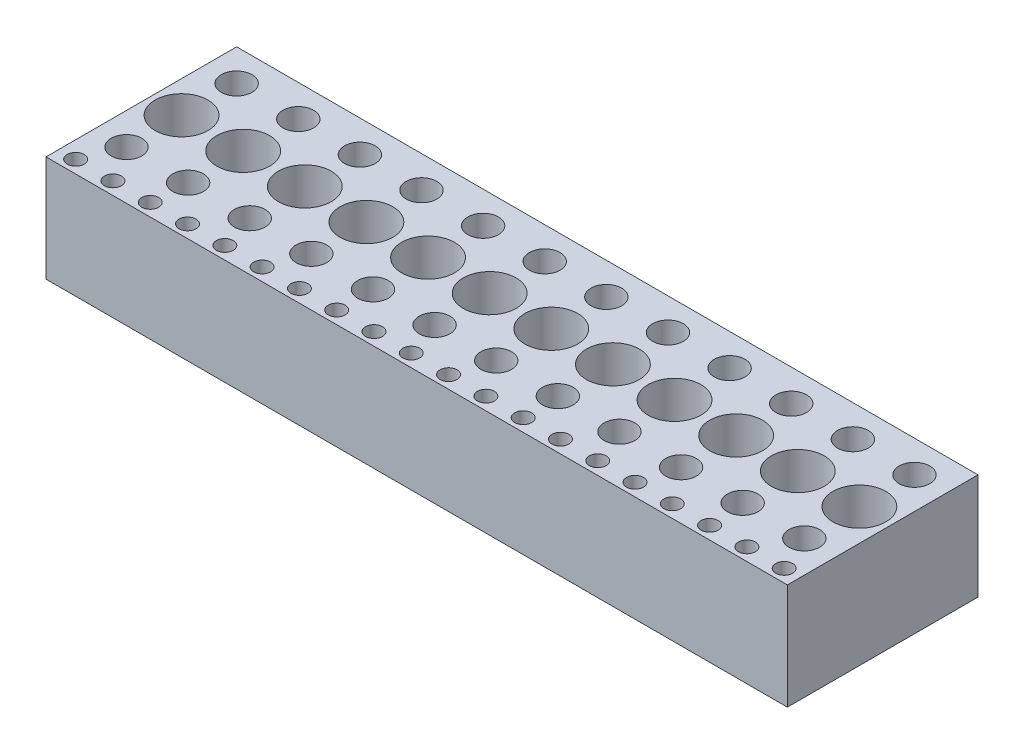
from build123d import *

# Parameters (mm, degrees)
SKETCH_1_W          = 35
SKETCH_1_H          = 9
EXTRUDE_1_DEPTH     = 5
SKETCH_2_R          = 0.725
SKETCH_2_R_2        = 1.25
SKETCH_2_R_3        = 0.4
CUT_EXTRUDE_1_DEPTH = 19.748333259


with BuildPart() as part:
    # 草图1 → 凸台-拉伸1 (new body)
    with BuildSketch(Plane(origin=(0, 0, 0), x_dir=(1, 0, 0), z_dir=(0, 1, 0))):
        Rectangle(SKETCH_1_W, SKETCH_1_H)
    extrude(amount=EXTRUDE_1_DEPTH)

    # 草图2 → 切除-拉伸1 (cut, through all)
    with BuildSketch(Plane(origin=(0, 5, 0), x_dir=(1, 0, 0), z_dir=(0, 1, 0))):
        with Locations(Location((-16, 3, 0), (0, 0, 270))):
            Circle(SKETCH_2_R)
        with Locations(Location((-13.090909091, 3, 0), (0, 0, 270))):
            Circle(SKETCH_2_R)
        with Locations(Location((-10.181818182, 3, 0), (0, 0, 270))):
            Circle(SKETCH_2_R)
        with Locations(Location((-7.272727273, 3, 0), (0, 0, 270))):
            Circle(SKETCH_2_R)
        with Locations(Location((-4.363636364, 3, 0), (0, 0, 270))):
            Circle(SKETCH_2_R)
        with Locations(Location((-1.454545455, 3, 0), (0, 0, 270))):
            Circle(SKETCH_2_R)
        with Locations(Location((1.454545455, 3, 0), (0, 0, 270))):
            Circle(SKETCH_2_R)
        with Locations(Location((4.363636364, 3, 0), (0, 0, 270))):
            Circle(SKETCH_2_R)
        with Locations(Location((7.272727273, 3, 0), (0, 0, 270))):
            Circle(SKETCH_2_R)
        with Locations(Location((10.181818182, 3, 0), (0, 0, 270))):
            Circle(SKETCH_2_R)
        with Locations(Location((13.090909091, 3, 0), (0, 0, 270))):
            Circle(SKETCH_2_R)
        with Locations(Location((16, 3, 0), (0, 0, 270))):
            Circle(SKETCH_2_R)
        with Locations(Location((-16, 0.4, 0), (0, 0, 270))):
            Circle(SKETCH_2_R_2)
        with Locations(Location((-13.090909091, 0.4, 0), (0, 0, 270))):
            Circle(SKETCH_2_R_2)
        with Locations(Location((-10.181818182, 0.4, 0), (0, 0, 270))):
            Circle(SKETCH_2_R_2)
        with Locations(Location((-7.272727273, 0.4, 0), (0, 0, 270))):
            Circle(SKETCH_2_R_2)
        with Locations(Location((-4.363636364, 0.4, 0), (0, 0, 270))):
            Circle(SKETCH_2_R_2)
        with Locations(Location((-1.454545455, 0.4, 0), (0, 0, 270))):
            Circle(SKETCH_2_R_2)
        with Locations(Location((1.454545455, 0.4, 0), (0, 0, 270))):
            Circle(SKETCH_2_R_2)
        with Locations(Location((4.363636364, 0.4, 0), (0, 0, 270))):
            Circle(SKETCH_2_R_2)
        with Locations(Location((7.272727273, 0.4, 0), (0, 0, 270))):
            Circle(SKETCH_2_R_2)
        with Locations(Location((10.181818182, 0.4, 0), (0, 0, 270))):
            Circle(SKETCH_2_R_2)
        with Locations(Location((13.090909091, 0.4, 0), (0, 0, 270))):
            Circle(SKETCH_2_R_2)
        with Locations(Location((16, 0.4, 0), (0, 0, 270))):
            Circle(SKETCH_2_R_2)
        with Locations(Location((-16, -2.2, 0), (0, 0, 270))):
            Circle(SKETCH_2_R)
        with Locations(Location((-13.090909091, -2.2, 0), (0, 0, 270))):
            Circle(SKETCH_2_R)
        with Locations(Location((-10.181818182, -2.2, 0), (0, 0, 270))):
            Circle(SKETCH_2_R)
        with Locations(Location((-7.272727273, -2.2, 0), (0, 0, 270))):
            Circle(SKETCH_2_R)
        with Locations(Location((-4.363636364, -2.2, 0), (0, 0, 270))):
            Circle(SKETCH_2_R)
        with Locations(Location((-1.454545455, -2.2, 0), (0, 0, 270))):
            Circle(SKETCH_2_R)
        with Locations(Location((1.454545455, -2.2, 0), (0, 0, 270))):
            Circle(SKETCH_2_R)
        with Locations(Location((4.363636364, -2.2, 0), (0, 0, 270))):
            Circle(SKETCH_2_R)
        with Locations(Location((7.272727273, -2.2, 0), (0, 0, 270))):
            Circle(SKETCH_2_R)
        with Locations(Location((10.181818182, -2.2, 0), (0, 0, 270))):
            Circle(SKETCH_2_R)
        with Locations(Location((13.090909091, -2.2, 0), (0, 0, 270))):
            Circle(SKETCH_2_R)
        with Locations(Location((16, -2.2, 0), (0, 0, 270))):
            Circle(SKETCH_2_R)
        with Locations(Location((-16.7, -3.9, 0), (0, 0, 270))):
            Circle(SKETCH_2_R_3)
        with Locations(Location((-14.939473684, -3.9, 0), (0, 0, 270))):
            Circle(SKETCH_2_R_3)
        with Locations(Location((-13.178947368, -3.9, 0), (0, 0, 270))):
            Circle(SKETCH_2_R_3)
        with Locations(Location((-11.418421053, -3.9, 0), (0, 0, 270))):
            Circle(SKETCH_2_R_3)
        with Locations(Location((-9.657894737, -3.9, 0), (0, 0, 270))):
            Circle(SKETCH_2_R_3)
        with Locations(Location((-7.897368421, -3.9, 0), (0, 0, 270))):
            Circle(SKETCH_2_R_3)
        with Locations(Location((-6.136842105, -3.9, 0), (0, 0, 270))):
            Circle(SKETCH_2_R_3)
        with Locations(Location((-4.376315789, -3.9, 0), (0, 0, 270))):
            Circle(SKETCH_2_R_3)
        with Locations(Location((-2.615789474, -3.9, 0), (0, 0, 270))):
            Circle(SKETCH_2_R_3)
        with Locations(Location((-0.855263158, -3.9, 0), (0, 0, 270))):
            Circle(SKETCH_2_R_3)
        with Locations(Location((0.905263158, -3.9, 0), (0, 0, 270))):
            Circle(SKETCH_2_R_3)
        with Locations(Location((2.665789474, -3.9, 0), (0, 0, 270))):
            Circle(SKETCH_2_R_3)
        with Locations(Location((4.426315789, -3.9, 0), (0, 0, 270))):
            Circle(SKETCH_2_R_3)
        with Locations(Location((6.186842105, -3.9, 0), (0, 0, 270))):
            Circle(SKETCH_2_R_3)
        with Locations(Location((7.947368421, -3.9, 0), (0, 0, 270))):
            Circle(SKETCH_2_R_3)
        with Locations(Location((9.707894737, -3.9, 0), (0, 0, 270))):
            Circle(SKETCH_2_R_3)
        with Locations(Location((11.468421053, -3.9, 0), (0, 0, 270))):
            Circle(SKETCH_2_R_3)
        with Locations(Location((13.228947368, -3.9, 0), (0, 0, 270))):
            Circle(SKETCH_2_R_3)
        with Locations(Location((14.989473684, -3.9, 0), (0, 0, 270))):
            Circle(SKETCH_2_R_3)
        with Locations(Location((16.75, -3.9, 0), (0, 0, 270))):
            Circle(SKETCH_2_R_3)
    extrude(amount=-CUT_EXTRUDE_1_DEPTH, mode=Mode.SUBTRACT)


solid = part.part
